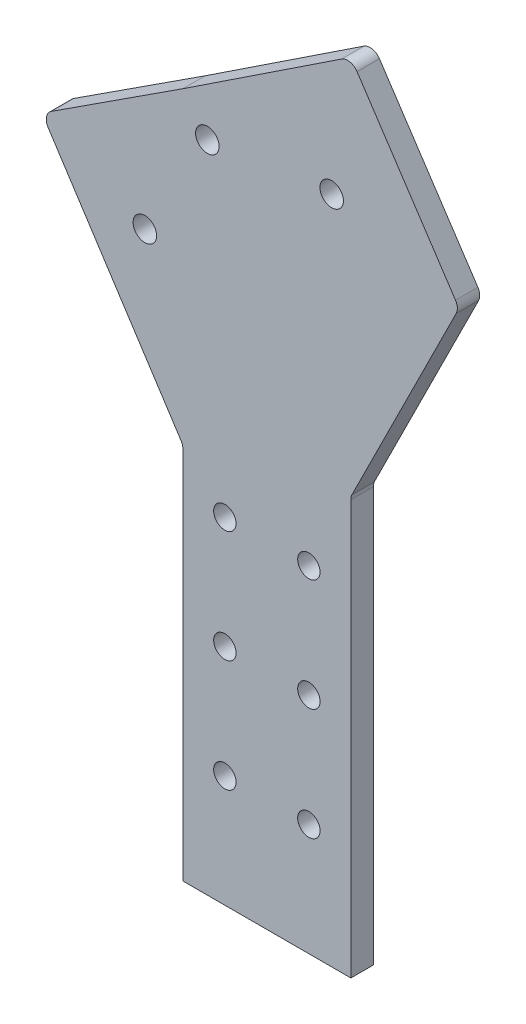
from build123d import *

# Parameters (mm, degrees)
EXTRUDE_1_DEPTH     = 4
CUT_EXTRUDE_1_REACH = 106.48
SKETCH_14_R         = 2
EXTRUDE_2_DEPTH     = 4
SKETCH_17_R         = 2.1
CUT_EXTRUDE_2_DEPTH = 10
EXTRUDE_3_DEPTH     = 4
FILLET_1_R          = 2


with BuildPart() as part:
    # 草图13 → 凸台-拉伸1 (new body)
    with BuildSketch(Plane.XY):
        Polygon((-30, -100), (0, -100), (0, 0), (0, 42.37433904), (-30, 22.517772204), align=None)
    extrude(amount=EXTRUDE_1_DEPTH)

    # 草图14 → 切除-拉伸1 (cut, up to next)
    with BuildSketch(Plane.XY.offset(4), mode=Mode.PRIVATE) as cut_extrude_1_sk1:
        with Locations((-22.5, -40)):
            Circle(SKETCH_14_R)
    cut_extrude_1_tool1 = extrude(cut_extrude_1_sk1.sketch, amount=-CUT_EXTRUDE_1_REACH, mode=Mode.PRIVATE) & part.part
    # 草图14 → 切除-拉伸1 (cut, up to next)
    with BuildSketch(Plane.XY.offset(4), mode=Mode.PRIVATE) as cut_extrude_1_sk2:
        with Locations((-7.5, -40)):
            Circle(SKETCH_14_R)
    cut_extrude_1_tool2 = extrude(cut_extrude_1_sk2.sketch, amount=-CUT_EXTRUDE_1_REACH, mode=Mode.PRIVATE) & part.part
    # 草图14 → 切除-拉伸1 (cut, up to next)
    with BuildSketch(Plane.XY.offset(4), mode=Mode.PRIVATE) as cut_extrude_1_sk3:
        with Locations((-7.5, -60)):
            Circle(SKETCH_14_R)
    cut_extrude_1_tool3 = extrude(cut_extrude_1_sk3.sketch, amount=-CUT_EXTRUDE_1_REACH, mode=Mode.PRIVATE) & part.part
    # 草图14 → 切除-拉伸1 (cut, up to next)
    with BuildSketch(Plane.XY.offset(4), mode=Mode.PRIVATE) as cut_extrude_1_sk4:
        with Locations((-7.5, -80)):
            Circle(SKETCH_14_R)
    cut_extrude_1_tool4 = extrude(cut_extrude_1_sk4.sketch, amount=-CUT_EXTRUDE_1_REACH, mode=Mode.PRIVATE) & part.part
    # 草图14 → 切除-拉伸1 (cut, up to next)
    with BuildSketch(Plane.XY.offset(4), mode=Mode.PRIVATE) as cut_extrude_1_sk5:
        with Locations((-22.5, -60)):
            Circle(SKETCH_14_R)
    cut_extrude_1_tool5 = extrude(cut_extrude_1_sk5.sketch, amount=-CUT_EXTRUDE_1_REACH, mode=Mode.PRIVATE) & part.part
    # 草图14 → 切除-拉伸1 (cut, up to next)
    with BuildSketch(Plane.XY.offset(4), mode=Mode.PRIVATE) as cut_extrude_1_sk6:
        with Locations((-22.5, -80)):
            Circle(SKETCH_14_R)
    cut_extrude_1_tool6 = extrude(cut_extrude_1_sk6.sketch, amount=-CUT_EXTRUDE_1_REACH, mode=Mode.PRIVATE) & part.part
    add(cut_extrude_1_tool1.solids().sort_by_distance((-22.5, -40, 4))[0], mode=Mode.SUBTRACT)
    add(cut_extrude_1_tool2.solids().sort_by_distance((-7.5, -40, 4))[0], mode=Mode.SUBTRACT)
    add(cut_extrude_1_tool3.solids().sort_by_distance((-7.5, -60, 4))[0], mode=Mode.SUBTRACT)
    add(cut_extrude_1_tool4.solids().sort_by_distance((-7.5, -80, 4))[0], mode=Mode.SUBTRACT)
    add(cut_extrude_1_tool5.solids().sort_by_distance((-22.5, -60, 4))[0], mode=Mode.SUBTRACT)
    add(cut_extrude_1_tool6.solids().sort_by_distance((-22.5, -80, 4))[0], mode=Mode.SUBTRACT)

    # 草图16 → 凸台-拉伸2 (add)
    with BuildSketch(Plane.XY.offset(4)):
        Polygon((-30, 22.517772204), (-55.160117038, 6.178601154), (-30, -32.564581559), align=None)
    extrude(amount=-EXTRUDE_2_DEPTH)

    # 草图17 → 切除-拉伸2 (cut)
    with BuildSketch(Plane.XY.offset(4)):
        with Locations((-3.429938262, 19.497880137)):
            Circle(SKETCH_17_R)
        with Locations((-25.627024556, 16.797998652)):
            Circle(SKETCH_17_R)
        with Locations((-36.785371145, -2.579599275)):
            Circle(SKETCH_17_R)
    extrude(amount=-CUT_EXTRUDE_2_DEPTH, mode=Mode.SUBTRACT)

    # 草图18 → 凸台-拉伸3 (add)
    with BuildSketch(Plane.XY.offset(4)):
        Polygon((0, 42.37433904), (19.317794486, 13.188335268), (0, -25.557166319), align=None)
    extrude(amount=-EXTRUDE_3_DEPTH)

    # 圆角1
    fillet_1_edges = [part.edges().sort_by_distance(p)[0] for p in [
        (-30, -32.564581559, 2),
        (-55.160117038, 6.178601154, 2),
        (0, -25.557166319, 2),
        (19.317794486, 13.188335268, 2),
        (0, 42.37433904, 2),
    ]]
    fillet(fillet_1_edges, radius=FILLET_1_R)


solid = part.part
